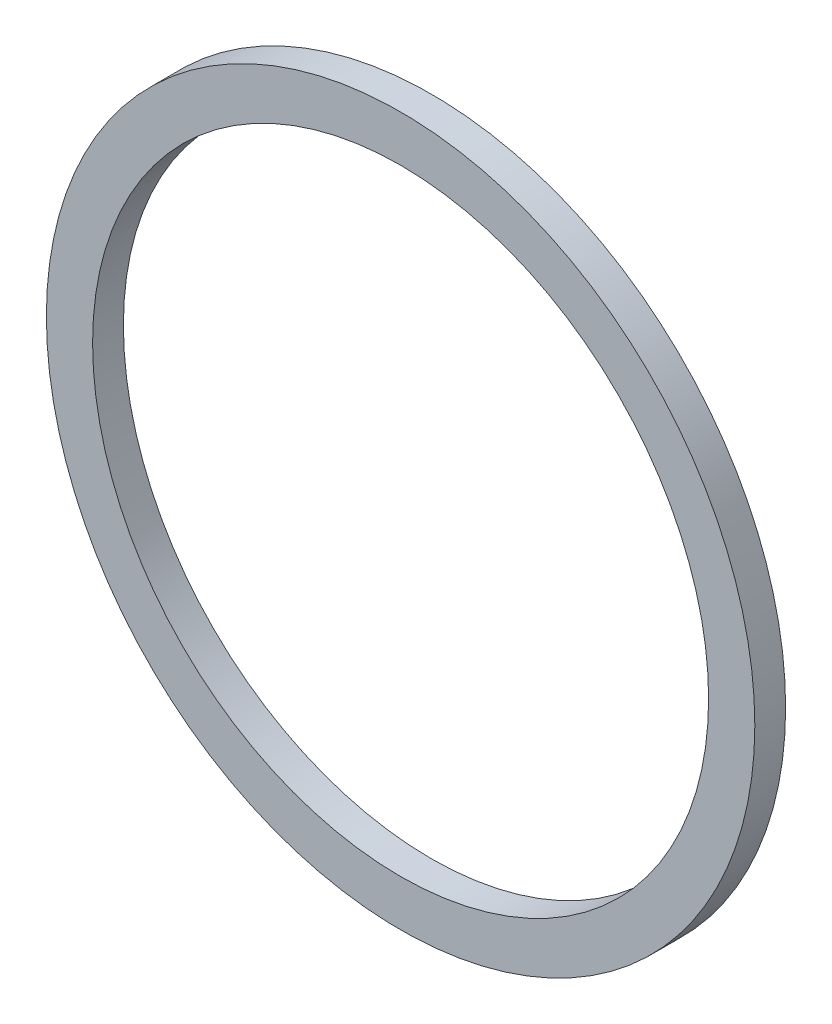
from build123d import *

# Parameters (mm, degrees)
SKETCH1_R           = 115
SKETCH1_R_2         = 100
BOSS_EXTRUDE1_DEPTH = 10


with BuildPart() as part:
    # Sketch1 → Boss-Extrude1 (new body)
    with BuildSketch(Plane.XY):
        Circle(SKETCH1_R)
        Circle(SKETCH1_R_2, mode=Mode.SUBTRACT)
    extrude(amount=BOSS_EXTRUDE1_DEPTH)


solid = part.part
